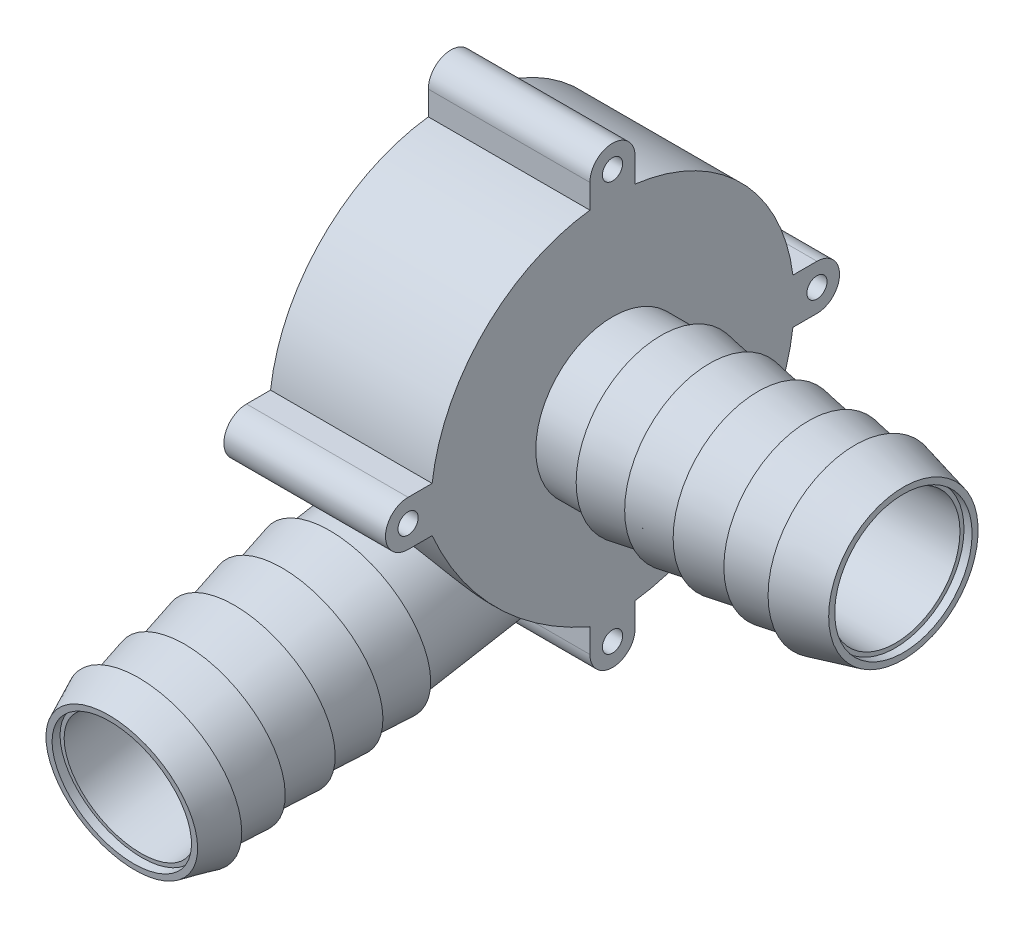
from build123d import *

# Parameters (mm, degrees)
SKETCH_2_R          = 22.5
EXTRUDE_1_DEPTH     = 20
CUT_EXTRUDE_START   = -1
SKETCH_3_R          = 8.5
SKETCH_3_R_2        = 8
CUT_EXTRUDE_1_DEPTH = 1
EXTRUDE_2_DEPTH     = 20
HOLE_WIZARD_M31_D   = 2.5
CUT_EXTRUDE_2_DEPTH = 54.62107794515138
SKETCH_9_R          = 9.5
EXTRUDE_4_DEPTH     = 19
CUT_EXTRUDE_3_DEPTH = 18
SKETCH_14_R         = 8.000000000000538
CUT_EXTRUDE_5_DEPTH = 20.999999999999996
CUT_EXTRUDE_START_2 = -20.999999999999996
SKETCH_15_R         = 8
CUT_EXTRUDE_6_DEPTH = 20.999999999999996
SKETCH_13_R         = 8.5
SKETCH_13_R_2       = 8.000000000000538
CUT_EXTRUDE_7_DEPTH = 1


with BuildPart() as part:
    # Эскиз1 → Повернуть1 (revolve)
    with BuildSketch(Plane.XY, mode=Mode.PRIVATE) as revolve_1_sk:
        Polygon((6.000000000000004, 9.500000000000005), (6.0000000000000036, 10.500000000000005), (12.000000000000004, 9.500000000000005), (12.000000000000004, 10.500000000000005), (18.000000000000004, 9.500000000000009), (18.000000000000004, 10.500000000000005), (24.238502938920437, 9.460249510179933), (24.238502938920437, 10.460249510179935), (30, 9.50000000000001), (30, 10.750000000000004), (35.99999999999999, 9.250000000000005), (35.99999999999999, 8.000000000000004), (0, 8), (0, 9.500000000000005), align=None)
    revolve(revolve_1_sk.sketch.rotate(Axis((0, 0, 0), (1, 0, 0)), 90), axis=Axis((0, 0, 0), (1, 0, 0)))

    # Эскиз2 → Бобышка-Вытянуть1 (add)
    with BuildSketch(Plane.ZY):
        Circle(SKETCH_2_R)
    extrude(amount=EXTRUDE_1_DEPTH)

    # Эскиз3 → Вырез-Вытянуть1 (cut)
    with BuildSketch(Plane(origin=(35.99999999999999, 0, 0), x_dir=(0, 0, -1), z_dir=(1, 0, 0)).offset(CUT_EXTRUDE_START)):
        Circle(SKETCH_3_R)
        with Locations(Location((0, 0, 0), (0, 0, 180))):
            Circle(SKETCH_3_R_2, mode=Mode.SUBTRACT)
    extrude(amount=CUT_EXTRUDE_1_DEPTH, mode=Mode.SUBTRACT)

    # Эскиз4 → Бобышка-Вытянуть2 (add)
    with BuildSketch(Plane(origin=(0, 0, 0), x_dir=(0, 0, -1), z_dir=(1, 0, 0))):
        with BuildLine():
            Line((25.30000000000001, 2.799999999999917), (22.325097984107497, 2.7999999999999274))
            ThreePointArc((22.325097984107497, 2.7999999999999274), (22.500000000000007, -7.244e-14), (22.32509798410748, -2.8000000000000718))
            Line((22.32509798410748, -2.8000000000000718), (25.29999999999999, -2.8000000000000824))
            ThreePointArc((25.29999999999999, -2.8000000000000824), (28.099999999999998, -9.585e-14), (25.30000000000001, 2.799999999999917))
        make_face()
        with BuildLine():
            Line((-2.800000000000002, 25.3), (-2.800000000000002, 22.325097984107487))
            ThreePointArc((-2.800000000000002, 22.325097984107487), (1.38e-15, 22.500000000000007), (2.799999999999997, 22.32509798410749))
            Line((2.799999999999997, 22.32509798410749), (2.799999999999997, 25.3))
            ThreePointArc((2.799999999999997, 25.3), (5.9e-16, 28.099999999999998), (-2.800000000000002, 25.3))
        make_face()
        with BuildLine():
            Line((2.7999999999998266, -25.300000000000022), (2.7999999999998475, -22.325097984107504))
            ThreePointArc((2.7999999999998475, -22.325097984107504), (-1.535e-13, -22.500000000000004), (-2.800000000000152, -22.32509798410747))
            Line((-2.800000000000152, -22.32509798410747), (-2.800000000000173, -25.29999999999998))
            ThreePointArc((-2.800000000000173, -25.29999999999998), (-1.9663e-13, -28.099999999999998), (2.7999999999998266, -25.300000000000022))
        make_face()
        with BuildLine():
            Line((-25.300000000000026, -2.7999999999997374), (-22.32509798410751, -2.7999999999997685))
            ThreePointArc((-22.32509798410751, -2.7999999999997685), (-22.500000000000007, 2.3257e-13), (-22.32509798410746, 2.800000000000231))
            Line((-22.32509798410746, 2.800000000000231), (-25.299999999999972, 2.8000000000002623))
            ThreePointArc((-25.299999999999972, 2.8000000000002623), (-28.099999999999998, 2.9312e-13), (-25.300000000000026, -2.7999999999997374))
        make_face()
    extrude(amount=-EXTRUDE_2_DEPTH)

    # Отверстие обработанное метчиком M31 (through all)
    with Locations(Plane(origin=(0, 0, 0), x_dir=(0, 0, -1), z_dir=(1, 0, 0))):
        with Locations((0, 25.3), (-25.3, 0), (0, -25.3), (25.3, 0)):
            Hole(HOLE_WIZARD_M31_D / 2)

    # Эскиз7 → Вырез-Вытянуть2 (cut, through all)
    with BuildSketch(Plane(origin=(0, 0, 0), x_dir=(0, 0, -1), z_dir=(1, 0, 0))):
        with BuildLine():
            ThreePointArc((-22.32509798410751, -2.7999999999997685), (-14.424368200146956, -14.424368200146706), (-2.8000000000001526, -22.32509798410747))
            ThreePointArc((-2.8000000000001526, -22.32509798410747), (-15.90990257669746, -15.909902576697181), (-22.32509798410751, -2.7999999999997685))
        make_face()
    extrude(amount=-CUT_EXTRUDE_2_DEPTH, mode=Mode.SUBTRACT)

    # Эскиз9 → Бобышка-Вытянуть4 (add)
    with BuildSketch(Plane(origin=(0, -1.1520122757155562, 6.533386275242313), x_dir=(1, 0, 0), z_dir=(0, -0.17364817766692384, 0.9848077530122092))):
        with Locations(Location((-10.000000000000002, -11.99971468403886, 0), (0, 0, 270))):
            Circle(SKETCH_9_R)
    extrude(amount=EXTRUDE_4_DEPTH)

    # Эскиз10 → Повернуть2 (revolve)
    with BuildSketch(Plane(origin=(-10, 0, 0), x_dir=(0, 0, -1), z_dir=(1, 0, 0)), mode=Mode.PRIVATE) as revolve_2_sk:
        Polygon((-27.24654564763845, -27.65111017879284), (-27.4201938253054, -26.66630242578063), (-21.337699129565245, -26.609221112791218), (-21.771819573732436, -24.147201730261234), (-49.34643665807445, -29.009350704935), (-49.1293764359908, -30.240360396200256), (-44.92967315744145, -31.022979315050762), (-45.146733379525074, -29.79196962378552), (-39.3060208272686, -29.737157320947013), (-39.4796690049355, -28.752349567934818), (-33.155392165711675, -28.692999244794482), (-33.32904034337858, -27.70819149178227), align=None)
    revolve(revolve_2_sk.sketch.rotate(Axis((-10, -16.268739706163032, 23.161004995067916), (0, -0.1736481776669369, 0.9848077530122069)), 180), axis=Axis((-10, -16.268739706163032, 23.161004995067916), (0, -0.1736481776669369, 0.9848077530122069)))

    # Эскиз12 → Вырез-Вытянуть3 (cut)
    with BuildSketch(Plane.ZY.offset(20)):
        with BuildLine():
            ThreePointArc((20.373939602323045, -2.2699306334980194), (-14.495689014324347, 14.495689014324102), (2.2699306334983786, -20.37393960232301))
            ThreePointArc((2.2699306334983786, -20.37393960232301), (13.01015463777385, -13.01015463777362), (20.373939602323045, -2.2699306334980194))
        make_face()
    extrude(amount=-CUT_EXTRUDE_3_DEPTH, mode=Mode.SUBTRACT)

    # Эскиз14 → Вырез-Вытянуть5 (cut)
    with BuildSketch(Plane(origin=(0, -4.451327651387111, 25.244733582474296), x_dir=(1, 0, 0), z_dir=(0, -0.17364817766692386, 0.9848077530122094))):
        with Locations(Location((-10, -11.999714684038862, 0), (0, 0, 90))):
            Circle(SKETCH_14_R)
    extrude(amount=-CUT_EXTRUDE_5_DEPTH, mode=Mode.SUBTRACT)

    # Эскиз15 → Вырез-Вытянуть6 (cut)
    with BuildSketch(Plane(origin=(0, 0, 0), x_dir=(0, 0, -1), z_dir=(1, 0, 0)).offset(CUT_EXTRUDE_START_2)):
        with Locations(Location((0, 0, 0), (0, 0, 180))):
            Circle(SKETCH_15_R)
    extrude(amount=CUT_EXTRUDE_6_DEPTH, mode=Mode.SUBTRACT)

    # Эскиз13 → Вырез-Вытянуть7 (cut)
    with BuildSketch(Plane(origin=(0, -9.313476626061751, 52.81935066681644), x_dir=(1, 0, 0), z_dir=(0, -0.17364817766693696, 0.9848077530122069))):
        with Locations(Location((-10, -11.999714684038523, 0), (0, 0, 270))):
            Circle(SKETCH_13_R)
        with Locations(Location((-10, -11.999714684038523, 0), (0, 0, 7.531e-06))):
            Circle(SKETCH_13_R_2, mode=Mode.SUBTRACT)
    extrude(amount=-CUT_EXTRUDE_7_DEPTH, mode=Mode.SUBTRACT)


solid = part.part
